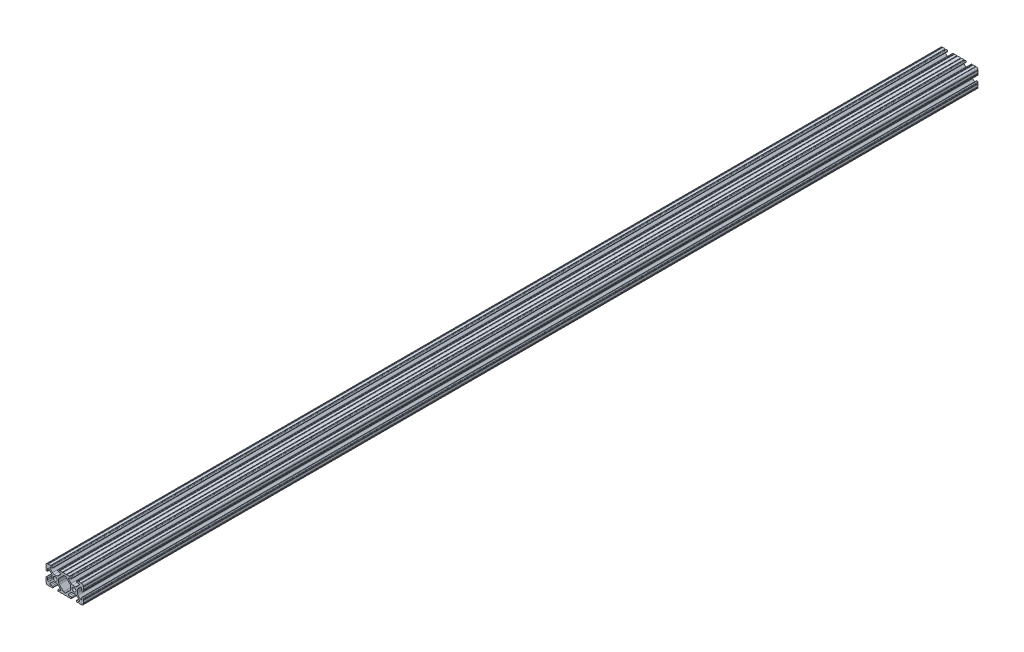
from build123d import *

# Parameters (mm, degrees)
SKETCH1_R           = 2.6035
BOSS_EXTRUDE1_DEPTH = 609.6


with BuildPart() as part:
    # Sketch1 → Boss-Extrude1 (new, symmetric)
    with BuildSketch(Plane.XY):
        with BuildLine():
            Line((18.01710265, 12.7), (16.98745015, 12.7))
            ThreePointArc((16.98745015, 12.7), (16.245730386, 12.392769614), (15.9385, 11.65104985))
            Line((15.9385, 11.65104985), (15.9385, 11.53922))
            ThreePointArc((15.9385, 11.53922), (16.245750844, 10.797450844), (16.98752, 10.4902))
            Line((16.98752, 10.4902), (19.116384363, 10.4902))
            ThreePointArc((19.116384363, 10.4902), (20.052502933, 9.869096983), (19.844087081, 8.765172272))
            Line((19.844087081, 8.765172272), (16.618993479, 5.455112286))
            ThreePointArc((16.618993479, 5.455112286), (15.578994274, 4.745442459), (14.344932584, 4.4958))
            Line((14.344932584, 4.4958), (11.083317835, 4.4958))
            ThreePointArc((11.083317835, 4.4958), (9.854330953, 4.743306833), (8.816955189, 5.447238587))
            Line((8.816955189, 5.447238587), (5.564154119, 8.762652677))
            ThreePointArc((5.564154119, 8.762652677), (5.352591412, 9.867473037), (6.289393385, 10.4902))
            Line((6.289393385, 10.4902), (8.41248, 10.4902))
            ThreePointArc((8.41248, 10.4902), (9.154249156, 10.797450844), (9.4615, 11.53922))
            Line((9.4615, 11.53922), (9.4615, 11.65104985))
            ThreePointArc((9.4615, 11.65104985), (9.154269614, 12.392769614), (8.41254985, 12.7))
            Line((8.41254985, 12.7), (7.38288465, 12.7))
            ThreePointArc((7.38288465, 12.7), (6.87488465, 12.192), (6.36688465, 12.7))
            Line((6.36688465, 12.7), (3.14958095, 12.7))
            ThreePointArc((3.14958095, 12.7), (2.64158095, 12.192), (2.13358095, 12.7))
            Line((2.13358095, 12.7), (-2.13358095, 12.7))
            ThreePointArc((-2.13358095, 12.7), (-2.64158095, 12.192), (-3.14958095, 12.7))
            Line((-3.14958095, 12.7), (-6.36689735, 12.7))
            ThreePointArc((-6.36689735, 12.7), (-6.87489735, 12.192), (-7.38289735, 12.7))
            Line((-7.38289735, 12.7), (-8.41254985, 12.7))
            ThreePointArc((-8.41254985, 12.7), (-9.154269614, 12.392769614), (-9.4615, 11.65104985))
            Line((-9.4615, 11.65104985), (-9.4615, 11.53922))
            ThreePointArc((-9.4615, 11.53922), (-9.154249156, 10.797450844), (-8.41248, 10.4902))
            Line((-8.41248, 10.4902), (-6.283641037, 10.4902))
            ThreePointArc((-6.283641037, 10.4902), (-5.297291557, 9.829633109), (-5.532576693, 8.666071843))
            Line((-5.532576693, 8.666071843), (-8.809985098, 5.416263103))
            ThreePointArc((-8.809985098, 5.416263103), (-9.836720513, 4.734920264), (-11.045536121, 4.4958))
            Line((-11.045536121, 4.4958), (-14.354463879, 4.4958))
            ThreePointArc((-14.354463879, 4.4958), (-15.563279487, 4.734920264), (-16.590014902, 5.416263103))
            Line((-16.590014902, 5.416263103), (-19.867423307, 8.666071843))
            ThreePointArc((-19.867423307, 8.666071843), (-20.102708443, 9.829633109), (-19.116358963, 10.4902))
            Line((-19.116358963, 10.4902), (-16.98752, 10.4902))
            ThreePointArc((-16.98752, 10.4902), (-16.245750844, 10.797450844), (-15.9385, 11.53922))
            Line((-15.9385, 11.53922), (-15.9385, 11.65104985))
            ThreePointArc((-15.9385, 11.65104985), (-16.245730386, 12.392769614), (-16.98745015, 12.7))
            Line((-16.98745015, 12.7), (-18.01711535, 12.7))
            ThreePointArc((-18.01711535, 12.7), (-18.52511535, 12.192), (-19.03311535, 12.7))
            Line((-19.03311535, 12.7), (-22.2504, 12.7))
            ThreePointArc((-22.2504, 12.7), (-22.758323491, 12.192000006), (-23.266399977, 12.699846982))
            ThreePointArc((-23.266399977, 12.699846982), (-24.782522516, 12.082522516), (-25.399846982, 10.566399977))
            ThreePointArc((-25.399846982, 10.566399977), (-24.892000006, 10.058323491), (-25.4, 9.5504))
            Line((-25.4, 9.5504), (-25.4, 6.3330836))
            ThreePointArc((-25.4, 6.3330836), (-24.892, 5.8250836), (-25.4, 5.3170836))
            Line((-25.4, 5.3170836), (-25.4, 4.237520184))
            ThreePointArc((-25.4, 4.237520184), (-25.107393763, 3.531106237), (-24.400979816, 3.2385))
            Line((-24.400979816, 3.2385), (-24.23922, 3.2385))
            ThreePointArc((-24.23922, 3.2385), (-23.497450844, 3.545750844), (-23.1902, 4.28752))
            Line((-23.1902, 4.28752), (-23.1902, 6.334741132))
            ThreePointArc((-23.1902, 6.334741132), (-22.556026952, 7.286023527), (-21.434002553, 7.066535717))
            Line((-21.434002553, 7.066535717), (-18.147950853, 3.808156468))
            ThreePointArc((-18.147950853, 3.808156468), (-17.452759693, 2.774838327), (-17.208501877, 1.553619571))
            Line((-17.208501877, 1.553619571), (-17.208501877, -1.695179196))
            ThreePointArc((-17.208501877, -1.695179196), (-17.450738657, -2.911536421), (-18.140486065, -3.942289578))
            Line((-18.140486065, -3.942289578), (-21.431579576, -7.227386226))
            ThreePointArc((-21.431579576, -7.227386226), (-22.55444896, -7.449940594), (-23.1902, -6.498002195))
            Line((-23.1902, -6.498002195), (-23.1902, -4.28752))
            ThreePointArc((-23.1902, -4.28752), (-23.497450844, -3.545750844), (-24.23922, -3.2385))
            Line((-24.23922, -3.2385), (-24.35098, -3.2385))
            ThreePointArc((-24.35098, -3.2385), (-25.092749156, -3.545750844), (-25.4, -4.28752))
            Line((-25.4, -4.28752), (-25.4, -5.3171344))
            ThreePointArc((-25.4, -5.3171344), (-24.892, -5.8251344), (-25.4, -6.3331344))
            Line((-25.4, -6.3331344), (-25.4, -9.5504))
            ThreePointArc((-25.4, -9.5504), (-24.892000006, -10.058323491), (-25.399846982, -10.566399977))
            ThreePointArc((-25.399846982, -10.566399977), (-24.782522516, -12.082522516), (-23.266399977, -12.699846982))
            ThreePointArc((-23.266399977, -12.699846982), (-22.758323491, -12.192000006), (-22.2504, -12.7))
            Line((-22.2504, -12.7), (-19.03308995, -12.7))
            ThreePointArc((-19.03308995, -12.7), (-18.52508995, -12.192), (-18.01708995, -12.7))
            Line((-18.01708995, -12.7), (-16.9874692, -12.7))
            ThreePointArc((-16.9874692, -12.7), (-16.245700044, -12.392749156), (-15.9384492, -11.65098))
            Line((-15.9384492, -11.65098), (-15.9384492, -11.53922))
            ThreePointArc((-15.9384492, -11.53922), (-16.245700044, -10.797450844), (-16.9874692, -10.4902))
            Line((-16.9874692, -10.4902), (-19.116358963, -10.4902))
            ThreePointArc((-19.116358963, -10.4902), (-20.055197748, -9.862578342), (-19.834124023, -8.755124678))
            Line((-19.834124023, -8.755124678), (-16.49660751, -5.423689618))
            ThreePointArc((-16.49660751, -5.423689618), (-15.467274017, -4.736928798), (-14.253591699, -4.4958))
            Line((-14.253591699, -4.4958), (-11.146408301, -4.4958))
            ThreePointArc((-11.146408301, -4.4958), (-9.932725983, -4.736928798), (-8.90339249, -5.423689618))
            Line((-8.90339249, -5.423689618), (-5.565875977, -8.755124678))
            ThreePointArc((-5.565875977, -8.755124678), (-5.344802252, -9.862578342), (-6.283641037, -10.4902))
            Line((-6.283641037, -10.4902), (-8.4125308, -10.4902))
            ThreePointArc((-8.4125308, -10.4902), (-9.154299956, -10.797450844), (-9.4615508, -11.53922))
            Line((-9.4615508, -11.53922), (-9.4615508, -11.65098))
            ThreePointArc((-9.4615508, -11.65098), (-9.154299956, -12.392749156), (-8.4125308, -12.7))
            Line((-8.4125308, -12.7), (-7.38287195, -12.7))
            ThreePointArc((-7.38287195, -12.7), (-6.87487195, -12.192), (-6.36687195, -12.7))
            Line((-6.36687195, -12.7), (-3.14960635, -12.7))
            ThreePointArc((-3.14960635, -12.7), (-2.64160635, -12.192), (-2.13360635, -12.7))
            Line((-2.13360635, -12.7), (2.13360635, -12.7))
            ThreePointArc((2.13360635, -12.7), (2.64159365, -12.1920127), (3.14958095, -12.7))
            Line((3.14958095, -12.7), (6.36691005, -12.7))
            ThreePointArc((6.36691005, -12.7), (6.87491005, -12.192), (7.38291005, -12.7))
            Line((7.38291005, -12.7), (8.4125308, -12.7))
            ThreePointArc((8.4125308, -12.7), (9.154299956, -12.392749156), (9.4615508, -11.65098))
            Line((9.4615508, -11.65098), (9.4615508, -11.53922))
            ThreePointArc((9.4615508, -11.53922), (9.154299956, -10.797450844), (8.4125308, -10.4902))
            Line((8.4125308, -10.4902), (6.289393385, -10.4902))
            ThreePointArc((6.289393385, -10.4902), (5.231590322, -9.783049717), (5.480677245, -8.535265862))
            Line((5.480677245, -8.535265862), (8.597933595, -5.423689618))
            ThreePointArc((8.597933595, -5.423689618), (9.627267088, -4.736928798), (10.840949406, -4.4958))
            Line((10.840949406, -4.4958), (14.102564155, -4.4958))
            ThreePointArc((14.102564155, -4.4958), (15.215927525, -4.697410182), (16.187895372, -5.276636531))
            Line((16.187895372, -5.276636531), (19.868247549, -8.482246082))
            ThreePointArc((19.868247549, -8.482246082), (20.188435806, -9.746879864), (19.116384363, -10.4902))
            Line((19.116384363, -10.4902), (16.9874692, -10.4902))
            ThreePointArc((16.9874692, -10.4902), (16.245700044, -10.797450844), (15.9384492, -11.53922))
            Line((15.9384492, -11.53922), (15.9384492, -11.65098))
            ThreePointArc((15.9384492, -11.65098), (16.245700044, -12.392749156), (16.9874692, -12.7))
            Line((16.9874692, -12.7), (18.01710265, -12.7))
            ThreePointArc((18.01710265, -12.7), (18.52510265, -12.192), (19.03310265, -12.7))
            Line((19.03310265, -12.7), (22.2504, -12.7))
            ThreePointArc((22.2504, -12.7), (22.758323491, -12.192000006), (23.266399977, -12.699846982))
            ThreePointArc((23.266399977, -12.699846982), (24.782522516, -12.082522516), (25.399846982, -10.566399977))
            ThreePointArc((25.399846982, -10.566399977), (24.892000006, -10.058323492), (25.4, -9.550400001))
            Line((25.4, -9.550400001), (25.4, -6.333083592))
            ThreePointArc((25.4, -6.333083592), (24.892000001, -5.825083593), (25.4, -5.317083593))
            Line((25.4, -5.317083593), (25.4, -4.237520184))
            ThreePointArc((25.4, -4.237520184), (25.107393763, -3.531106237), (24.400979816, -3.2385))
            Line((24.400979816, -3.2385), (24.189220184, -3.2385))
            ThreePointArc((24.189220184, -3.2385), (23.482806237, -3.531106237), (23.1902, -4.237520184))
            Line((23.1902, -4.237520184), (23.1902, -6.155876159))
            ThreePointArc((23.1902, -6.155876159), (22.62232736, -7.038258539), (21.583974541, -6.886926384))
            Line((21.583974541, -6.886926384), (18.29817066, -4.024970844))
            ThreePointArc((18.29817066, -4.024970844), (17.493730985, -2.946044689), (17.208501877, -1.630807374))
            Line((17.208501877, -1.630807374), (17.208501877, 1.630807374))
            ThreePointArc((17.208501877, 1.630807374), (17.442348332, 2.82673414), (18.109440981, 3.846495088))
            Line((18.109440981, 3.846495088), (21.526346532, 7.353420386))
            ThreePointArc((21.526346532, 7.353420386), (22.585896263, 7.574939077), (23.1902, 6.676867167))
            Line((23.1902, 6.676867167), (23.1902, 4.237520184))
            ThreePointArc((23.1902, 4.237520184), (23.482806237, 3.531106237), (24.189220184, 3.2385))
            Line((24.189220184, 3.2385), (24.400979816, 3.2385))
            ThreePointArc((24.400979816, 3.2385), (25.107393763, 3.531106237), (25.4, 4.237520184))
            Line((25.4, 4.237520184), (25.4, 5.3170836))
            ThreePointArc((25.4, 5.3170836), (24.891949193, 5.825134407), (25.4, 6.333185215))
            Line((25.4, 6.333185215), (25.4, 9.550400015))
            ThreePointArc((25.4, 9.550400015), (24.892000013, 10.058323498), (25.399846982, 10.566399977))
            ThreePointArc((25.399846982, 10.566399977), (24.782522516, 12.082522516), (23.266399977, 12.699846982))
            ThreePointArc((23.266399977, 12.699846982), (22.758323491, 12.192000006), (22.2504, 12.7))
            Line((22.2504, 12.7), (19.03310265, 12.7))
            ThreePointArc((19.03310265, 12.7), (18.52510265, 12.192), (18.01710265, 12.7))
        make_face()
        with Locations(Location((-12.7, 0, 0), (0, 0, 180))):
            Circle(SKETCH1_R, mode=Mode.SUBTRACT)
        with Locations(Location((12.7, 0, 0), (0, 0, 180))):
            Circle(SKETCH1_R, mode=Mode.SUBTRACT)
        with BuildLine():
            Line((-7.259513935, -3.869413038), (-1.545748891, -9.572766749))
            ThreePointArc((-1.545748891, -9.572766749), (-1.035199478, -9.913400116), (-0.433213048, -10.033))
            Line((-0.433213048, -10.033), (0.433213048, -10.033))
            ThreePointArc((0.433213048, -10.033), (1.035199478, -9.913400116), (1.545748891, -9.572766749))
            Line((1.545748891, -9.572766749), (7.259513935, -3.869413038))
            ThreePointArc((7.259513935, -3.869413038), (7.949261343, -2.838659881), (8.191498123, -1.622302656))
            Line((8.191498123, -1.622302656), (8.191498123, 1.622302656))
            ThreePointArc((8.191498123, 1.622302656), (7.955573352, 2.823327967), (7.282860769, 3.845864069))
            Line((7.282860769, 3.845864069), (1.675572808, 9.561086461))
            ThreePointArc((1.675572808, 9.561086461), (1.161034429, 9.910236611), (0.551456936, 10.033))
            Line((0.551456936, 10.033), (-0.395199982, 10.033))
            ThreePointArc((-0.395199982, 10.033), (-0.994772524, 9.914396349), (-1.50403329, 9.576450301))
            Line((-1.50403329, 9.576450301), (-7.252049147, 3.876839553))
            ThreePointArc((-7.252049147, 3.876839553), (-7.947240307, 2.843521412), (-8.191498123, 1.622302656))
            Line((-8.191498123, 1.622302656), (-8.191498123, -1.622302656))
            ThreePointArc((-8.191498123, -1.622302656), (-7.949261343, -2.838659881), (-7.259513935, -3.869413038))
        make_face(mode=Mode.SUBTRACT)
    extrude(amount=BOSS_EXTRUDE1_DEPTH, both=True)


solid = part.part
